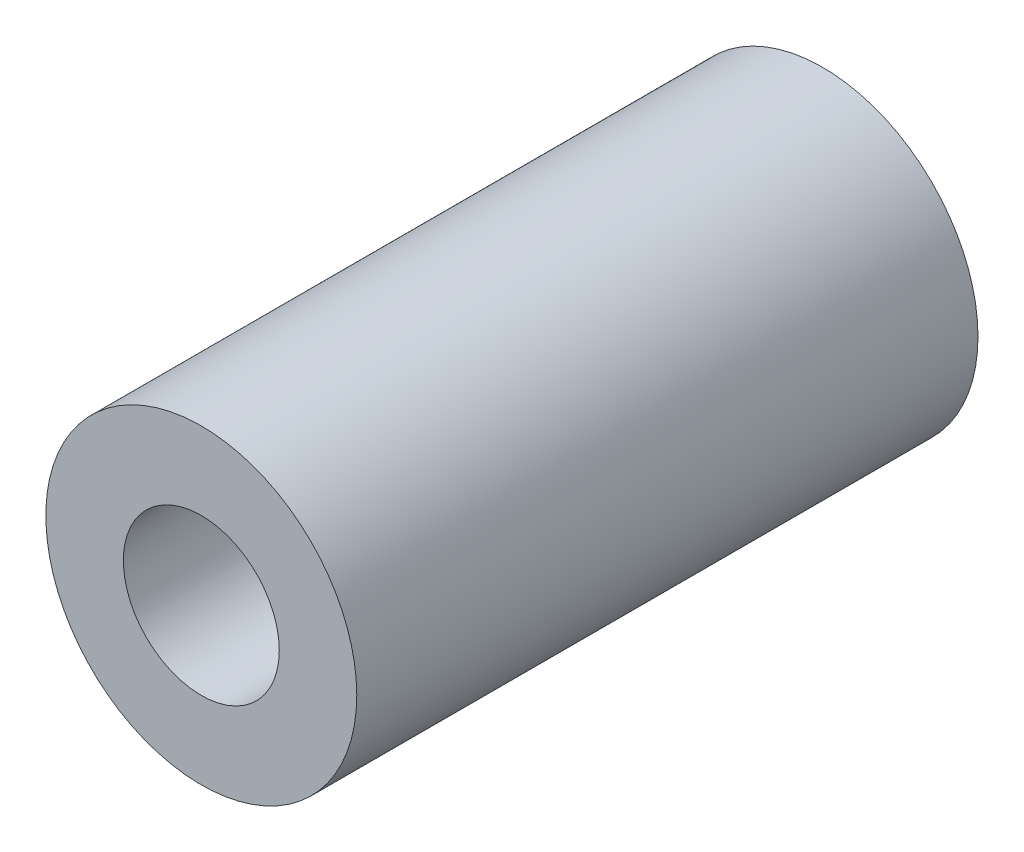
from build123d import *

# Parameters (mm, degrees)
SKETCH1_R      = 6.35635
SKETCH1_R_2    = 3.1877
EXTRUDE1_DEPTH = 12.7


with BuildPart() as part:
    # Sketch1 → Extrude1 (new, symmetric)
    with BuildSketch(Plane.XY):
        Circle(SKETCH1_R)
        Circle(SKETCH1_R_2, mode=Mode.SUBTRACT)
    extrude(amount=EXTRUDE1_DEPTH, both=True)


solid = part.part
